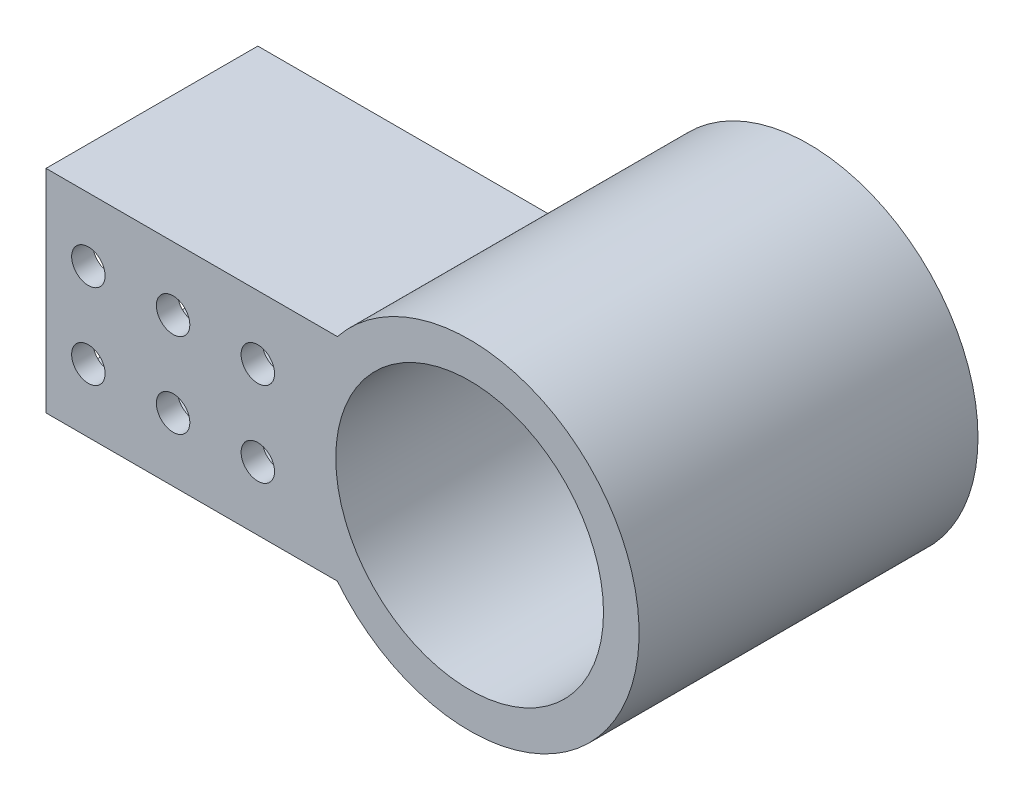
from build123d import *

# Parameters (mm, degrees)
SKETCH1_R           = 25.4
SKETCH1_R_2         = 20.066
BOSS_EXTRUDE1_DEPTH = 50.8
BOSS_EXTRUDE2_START = -31.75
BOSS_EXTRUDE2_DEPTH = 31.75
SKETCH3_W           = 25.4
SKETCH3_H           = 25.4
CUT_EXTRUDE1_DEPTH  = 38.1
SKETCH4_R           = 2.50825
CUT_EXTRUDE2_DEPTH  = 31.75
LPATTERN1_COUNT     = 3
LPATTERN1_PITCH     = 12.7


with BuildPart() as part:
    # Sketch1 → Boss-Extrude1 (new body)
    with BuildSketch(Plane.XY):
        Circle(SKETCH1_R)
        Circle(SKETCH1_R_2, mode=Mode.SUBTRACT)
    extrude(amount=BOSS_EXTRUDE1_DEPTH)

    # Sketch2 → Boss-Extrude2 (add)
    with BuildSketch(Plane.XY.offset(50.8).offset(BOSS_EXTRUDE2_START)):
        with BuildLine():
            Line((-19.827868645, 15.875), (-63.5, 15.875))
            Line((-63.5, 15.875), (-63.5, -15.875))
            Line((-63.5, -15.875), (-19.827868645, -15.875))
            ThreePointArc((-19.827868645, -15.875), (-25.4, 0), (-19.827868645, 15.875))
        make_face()
    extrude(amount=BOSS_EXTRUDE2_DEPTH)

    # Sketch3 → Cut-Extrude1 (cut)
    with BuildSketch(Plane.ZY.offset(63.5)):
        with Locations((34.925, 0)):
            Rectangle(SKETCH3_W, SKETCH3_H)
    extrude(amount=-CUT_EXTRUDE1_DEPTH, mode=Mode.SUBTRACT)

    # Sketch4 → Cut-Extrude2 (cut)
    with BuildSketch(Plane.XY.offset(50.8)):
        with Locations((-57.15, 6.35)):
            Circle(SKETCH4_R)
        with Locations((-57.15, -6.35)):
            Circle(SKETCH4_R)
    cut_extrude2 = extrude(amount=-CUT_EXTRUDE2_DEPTH, mode=Mode.SUBTRACT)

    # LPattern1: Cut-Extrude2 ×3
    with Locations(*[(i * LPATTERN1_PITCH, 0, 0) for i in range(1, LPATTERN1_COUNT)]):
        add(cut_extrude2, mode=Mode.SUBTRACT)


solid = part.part
